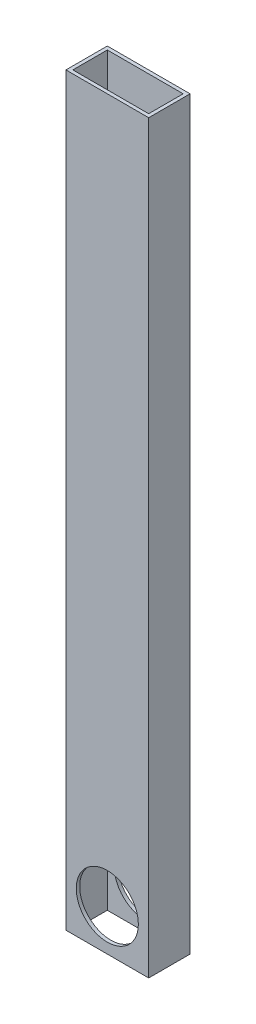
from build123d import *

# Parameters (mm, degrees)
SKETCH1_W           = 38.1
SKETCH1_H           = 19.05
SKETCH1_W_2         = 34.925
SKETCH1_H_2         = 15.875
EXTRUDE_THIN1_DEPTH = 342.9
SKETCH3_R           = 14.2875
CUT_EXTRUDE2_DEPTH  = 346.535703654


with BuildPart() as part:
    # Sketch1 → Extrude-Thin1 (new body)
    with BuildSketch(Plane(origin=(0, 0, 0), x_dir=(1, 0, 0), z_dir=(0, 1, 0))):
        with Locations((19.05, 9.525)):
            Rectangle(SKETCH1_W, SKETCH1_H)
        with Locations((19.05, 9.525)):
            Rectangle(SKETCH1_W_2, SKETCH1_H_2, mode=Mode.SUBTRACT)
    extrude(amount=EXTRUDE_THIN1_DEPTH)

    # Sketch3 → Cut-Extrude2 (cut, through all)
    with BuildSketch(Plane.XY):
        with Locations((19.05, 19.05)):
            Circle(SKETCH3_R)
    extrude(amount=-CUT_EXTRUDE2_DEPTH, mode=Mode.SUBTRACT)


solid = part.part
